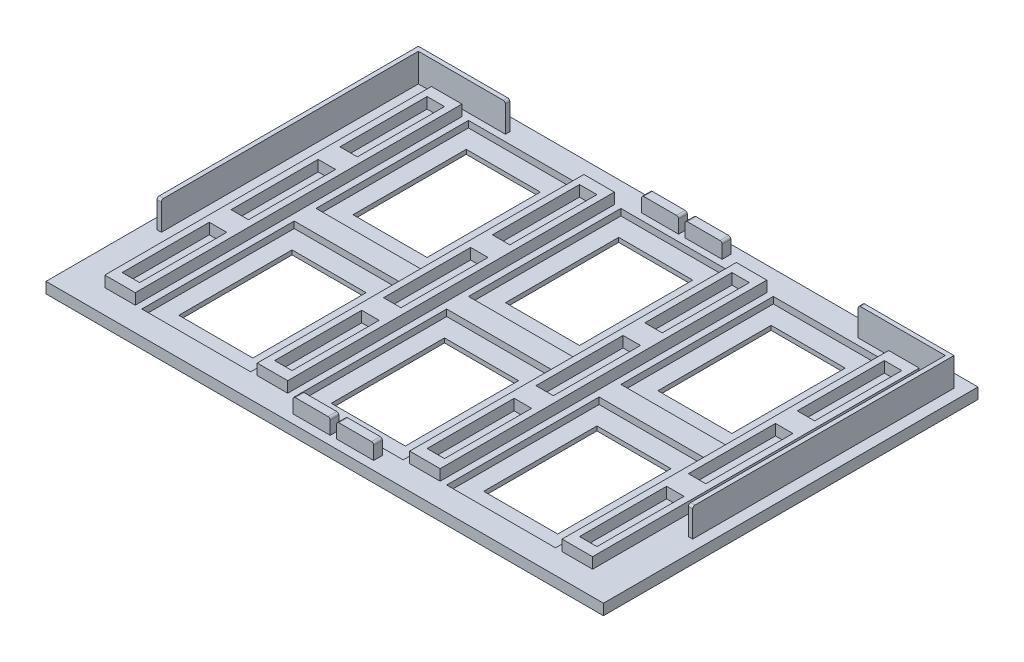
from build123d import *

# Parameters (mm, degrees)
SKETCH2_W           = 128
SKETCH2_H           = 86
BOSS_EXTRUDE1_DEPTH = 2.5
SKETCH9_W           = 8.5
SKETCH9_H           = 2
BOSS_EXTRUDE3_DEPTH = 6.5
CUT_EXTRUDE9_START  = 3.5
SKETCH10_W          = 8.5
SKETCH10_H          = 2
CUT_EXTRUDE9_DEPTH  = 74.877322259
FILLET1_R           = 0.5
SKETCH3_W           = 25
SKETCH3_H           = 35
CUT_EXTRUDE10_DEPTH = 1.5
SKETCH11_W          = 17
SKETCH11_H          = 26
CUT_EXTRUDE11_DEPTH = 10
SKETCH12_W          = 7
SKETCH12_H          = 75
SKETCH12_W_2        = 4
SKETCH12_H_2        = 20
BOSS_EXTRUDE4_DEPTH = 2.5


with BuildPart() as part:
    # Sketch2 → Boss-Extrude1 (new body)
    with BuildSketch(Plane(origin=(0, 0, 0), x_dir=(1, 0, 0), z_dir=(0, 1, 0))):
        Rectangle(SKETCH2_W, SKETCH2_H)
    extrude(amount=-BOSS_EXTRUDE1_DEPTH)

    # Sketch9 → Boss-Extrude3 (add)
    with BuildSketch(Plane(origin=(0, 0, 0), x_dir=(1, 0, 0), z_dir=(0, 1, 0))):
        Polygon((-61.5, -20), (-60.5, -20), (-60.5, 39), (-40.5, 39), (-40.5, 40), (-61.5, 40), align=None)
        Polygon((40.5, 40), (61.5, 40), (61.5, -20), (60.5, -20), (60.5, 39), (40.5, 39), align=None)
        with Locations((-5, 40)):
            Rectangle(SKETCH9_W, SKETCH9_H)
        with Locations((5, 40)):
            Rectangle(SKETCH9_W, SKETCH9_H)
        with Locations((-5, -40)):
            Rectangle(SKETCH9_W, SKETCH9_H)
        with Locations((5, -40)):
            Rectangle(SKETCH9_W, SKETCH9_H)
    extrude(amount=BOSS_EXTRUDE3_DEPTH)

    # Sketch10 → Cut-Extrude9 (cut, through all)
    with BuildSketch(Plane(origin=(0, 0, 0), x_dir=(1, 0, 0), z_dir=(0, 1, 0)).offset(CUT_EXTRUDE9_START)):
        with Locations((-5, 40)):
            Rectangle(SKETCH10_W, SKETCH10_H)
        with Locations((5, 40)):
            Rectangle(SKETCH10_W, SKETCH10_H)
        with Locations((-5, -40)):
            Rectangle(SKETCH10_W, SKETCH10_H)
        with Locations((5, -40)):
            Rectangle(SKETCH10_W, SKETCH10_H)
    extrude(amount=CUT_EXTRUDE9_DEPTH, mode=Mode.SUBTRACT)

    # Fillet1
    fillet1_edges = [part.edges().sort_by_distance(p)[0] for p in [
        (0.75, 3.5, -40),
        (9.25, 3.5, -40),
        (-9.25, 3.5, 40),
        (-0.75, 3.5, 40),
        (0.75, 3.5, 40),
        (9.25, 3.5, 40),
        (-9.25, 3.5, -40),
        (-0.75, 3.5, -40),
        (40.5, 6.5, -39.5),
        (61, 6.5, 20),
        (-61, 6.5, 20),
        (-40.5, 6.5, -39.5),
    ]]
    fillet(fillet1_edges, radius=FILLET1_R)

    # Sketch3 → Cut-Extrude10 (cut)
    with BuildSketch(Plane(origin=(0, 0, 0), x_dir=(1, 0, 0), z_dir=(0, 1, 0))):
        with Locations((-35, 20)):
            Rectangle(SKETCH3_W, SKETCH3_H)
        with Locations((-35, -20)):
            Rectangle(SKETCH3_W, SKETCH3_H)
        with Locations((0, 20)):
            Rectangle(SKETCH3_W, SKETCH3_H)
        with Locations((0, -20)):
            Rectangle(SKETCH3_W, SKETCH3_H)
        with Locations((35, 20)):
            Rectangle(SKETCH3_W, SKETCH3_H)
        with Locations((35, -20)):
            Rectangle(SKETCH3_W, SKETCH3_H)
    extrude(amount=-CUT_EXTRUDE10_DEPTH, mode=Mode.SUBTRACT)

    # Sketch11 → Cut-Extrude11 (cut)
    with BuildSketch(Plane(origin=(0, 0, 0), x_dir=(1, 0, 0), z_dir=(0, 1, 0))):
        with Locations((0, -20)):
            Rectangle(SKETCH11_W, SKETCH11_H)
        with Locations((-35, -20)):
            Rectangle(SKETCH11_W, SKETCH11_H)
        with Locations((0, 20)):
            Rectangle(SKETCH11_W, SKETCH11_H)
        with Locations((35, 20)):
            Rectangle(SKETCH11_W, SKETCH11_H)
        with Locations((35, -20)):
            Rectangle(SKETCH11_W, SKETCH11_H)
        with Locations((-35, 20)):
            Rectangle(SKETCH11_W, SKETCH11_H)
    extrude(amount=-CUT_EXTRUDE11_DEPTH, mode=Mode.SUBTRACT)

    # Sketch12 → Boss-Extrude4 (add)
    # profile 1 of 4: a face of its own
    with BuildSketch(Plane(origin=(0, 0, 0), x_dir=(1, 0, 0), z_dir=(0, 1, 0))):
        with Locations((-17.5, 0)):
            Rectangle(SKETCH12_W, SKETCH12_H)
        with Locations((-17.5, 0)):
            Rectangle(SKETCH12_W_2, SKETCH12_H_2, mode=Mode.SUBTRACT)
        with Locations((-17.5, 25)):
            Rectangle(SKETCH12_W_2, SKETCH12_H_2, mode=Mode.SUBTRACT)
        with Locations((-17.5, -25)):
            Rectangle(SKETCH12_W_2, SKETCH12_H_2, mode=Mode.SUBTRACT)
    # profile 2 of 4: a face of its own
    with BuildSketch(Plane(origin=(0, 0, 0), x_dir=(1, 0, 0), z_dir=(0, 1, 0))):
        with Locations((-52.5, 0)):
            Rectangle(SKETCH12_W, SKETCH12_H)
        with Locations((-52.5, -25)):
            Rectangle(SKETCH12_W_2, SKETCH12_H_2, mode=Mode.SUBTRACT)
        with Locations((-52.5, 0)):
            Rectangle(SKETCH12_W_2, SKETCH12_H_2, mode=Mode.SUBTRACT)
        with Locations((-52.5, 25)):
            Rectangle(SKETCH12_W_2, SKETCH12_H_2, mode=Mode.SUBTRACT)
    # profile 3 of 4: a face of its own
    with BuildSketch(Plane(origin=(0, 0, 0), x_dir=(1, 0, 0), z_dir=(0, 1, 0))):
        with Locations((17.5, 0)):
            Rectangle(SKETCH12_W, SKETCH12_H)
        with Locations((17.5, -25)):
            Rectangle(SKETCH12_W_2, SKETCH12_H_2, mode=Mode.SUBTRACT)
        with Locations((17.5, 0)):
            Rectangle(SKETCH12_W_2, SKETCH12_H_2, mode=Mode.SUBTRACT)
        with Locations((17.5, 25)):
            Rectangle(SKETCH12_W_2, SKETCH12_H_2, mode=Mode.SUBTRACT)
    # profile 4 of 4: a face of its own
    with BuildSketch(Plane(origin=(0, 0, 0), x_dir=(1, 0, 0), z_dir=(0, 1, 0))):
        with Locations((52.5, 0)):
            Rectangle(SKETCH12_W, SKETCH12_H)
        with Locations((52.5, -25)):
            Rectangle(SKETCH12_W_2, SKETCH12_H_2, mode=Mode.SUBTRACT)
        with Locations((52.5, 0)):
            Rectangle(SKETCH12_W_2, SKETCH12_H_2, mode=Mode.SUBTRACT)
        with Locations((52.5, 25)):
            Rectangle(SKETCH12_W_2, SKETCH12_H_2, mode=Mode.SUBTRACT)
    extrude(amount=BOSS_EXTRUDE4_DEPTH)


solid = part.part
